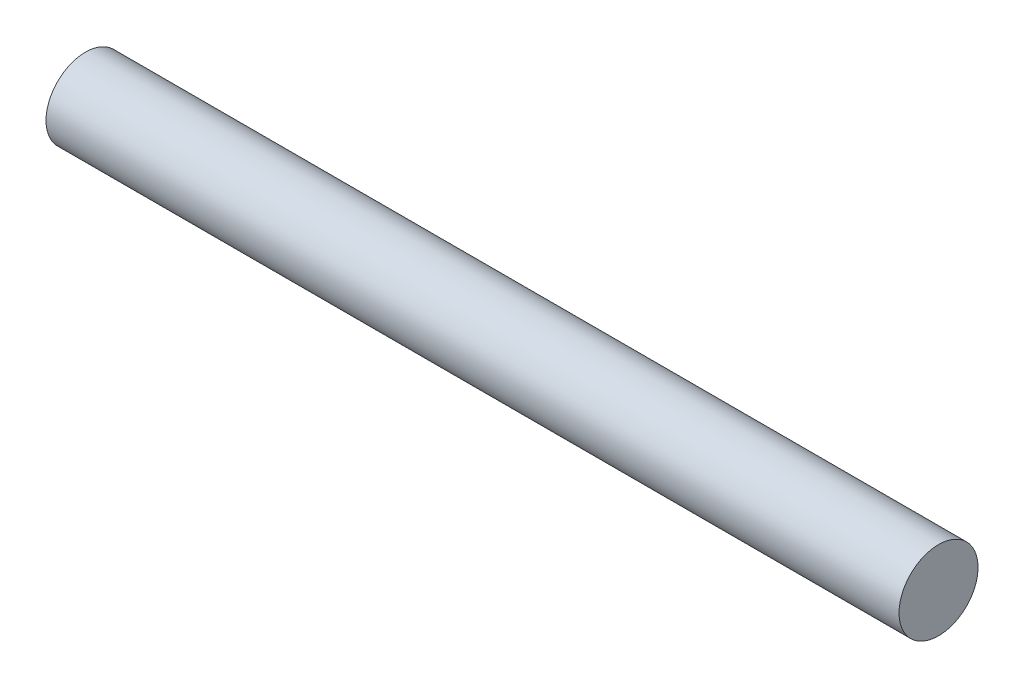
from build123d import *


with BuildPart() as part:
    # Sketch2 → Revolve1 (revolve)
    with BuildSketch(Plane(origin=(0, 0, 0), x_dir=(1, 0, 0), z_dir=(0, 1, 0)), mode=Mode.PRIVATE) as revolve1_sk:
        Polygon((23.488430543, 0), (20, 3), (3.441659847, 3), (1.697444576, 4.5), (0, 4.5), (0, 5.25), (113.292859099, 5.25), (113.292859099, 0), align=None)
    revolve(revolve1_sk.sketch.rotate(Axis((-33.987774488, 0, 0), (1, 0, 0)), 180), axis=Axis((-33.987774488, 0, 0), (1, 0, 0)))


solid = part.part
